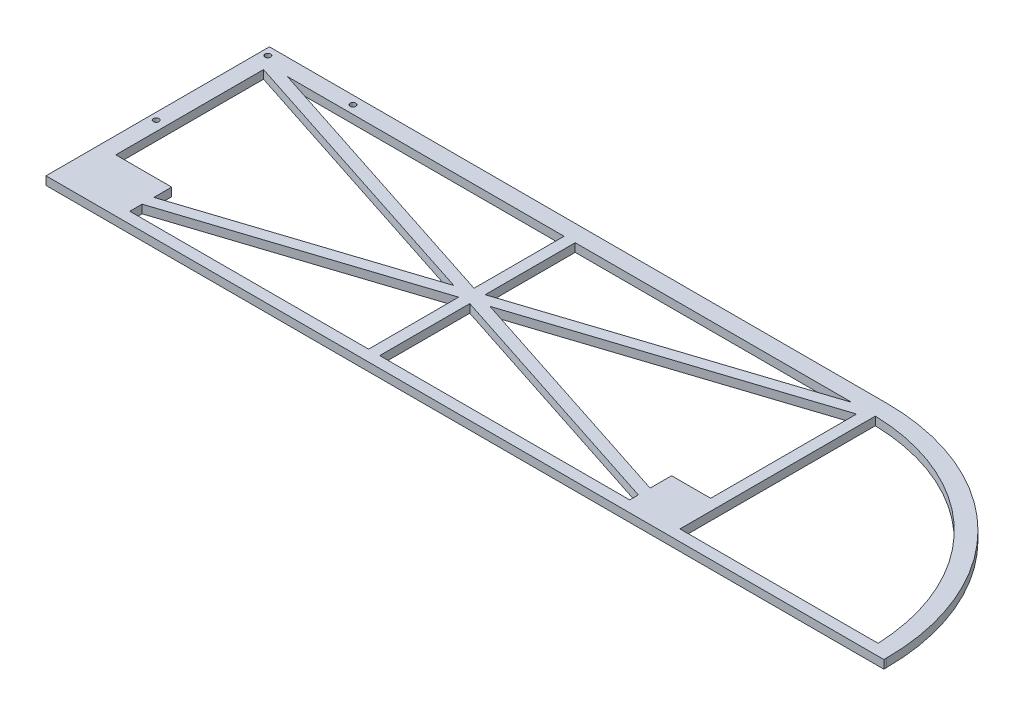
from build123d import *

# Parameters (mm, degrees)
SKETCH_1_R          = 1
EXTRUDE_1_DEPTH     = 3
CUT_EXTRUDE_2_DEPTH = 18


with BuildPart() as part:
    # 草图1 → 凸台-拉伸1 (new body)
    with BuildSketch(Plane(origin=(0, 0, 0), x_dir=(1, 0, 0), z_dir=(0, 1, 0))):
        with BuildLine():
            Line((-150, 40), (71, 40))
            ThreePointArc((71, 40), (126.861435714, 16.861435714), (150, -39))
            Line((150, -39), (150, -40))
            Line((150, -40), (-150, -40))
            Line((-150, -40), (-150, 40))
        make_face()
        with Locations(Location((-117.057778193, 37, 0), (0, 0, 270))):
            Circle(SKETCH_1_R, mode=Mode.SUBTRACT)
        with Locations(Location((-147.557778193, 37, 0), (0, 0, 270))):
            Circle(SKETCH_1_R, mode=Mode.SUBTRACT)
        with Locations(Location((-147.557778193, -3, 0), (0, 0, 270))):
            Circle(SKETCH_1_R, mode=Mode.SUBTRACT)
    extrude(amount=EXTRUDE_1_DEPTH)

    # 草图4 → 切除-拉伸2 (cut)
    with BuildSketch(Plane(origin=(0, 0, 0), x_dir=(1, 0, 0), z_dir=(0, 1, 0))):
        with BuildLine():
            ThreePointArc((143.938330115, -36), (122.26382188, 12.971343703), (73, 33.972597597))
            Line((73, 33.972597597), (73, -36))
            Line((73, -36), (143.938330115, -36))
        make_face()
        Polygon((-34.5, 1.754496568), (64.53976054, 34), (-34.5, 34), align=None)
        Polygon((69, -21), (69, 31.245503432), (-30.03976054, -1), (55, -28.687363897), (55, -21), align=None)
        Polygon((-38.5, 1.754496568), (-38.5, 34), (-137.53976054, 34), align=None)
        Polygon((55, -36), (55, -32.894031452), (-34.5, -3.754496568), (-34.5, -36), align=None)
        Polygon((-124, -27.385038315), (-42.96023946, -1), (-144, 31.896666222), (-144, -21), (-124, -21), align=None)
        Polygon((-38.5, -36), (-38.5, -3.754496568), (-124, -31.591705871), (-124, -36), align=None)
    extrude(amount=CUT_EXTRUDE_2_DEPTH, mode=Mode.SUBTRACT)


solid = part.part
